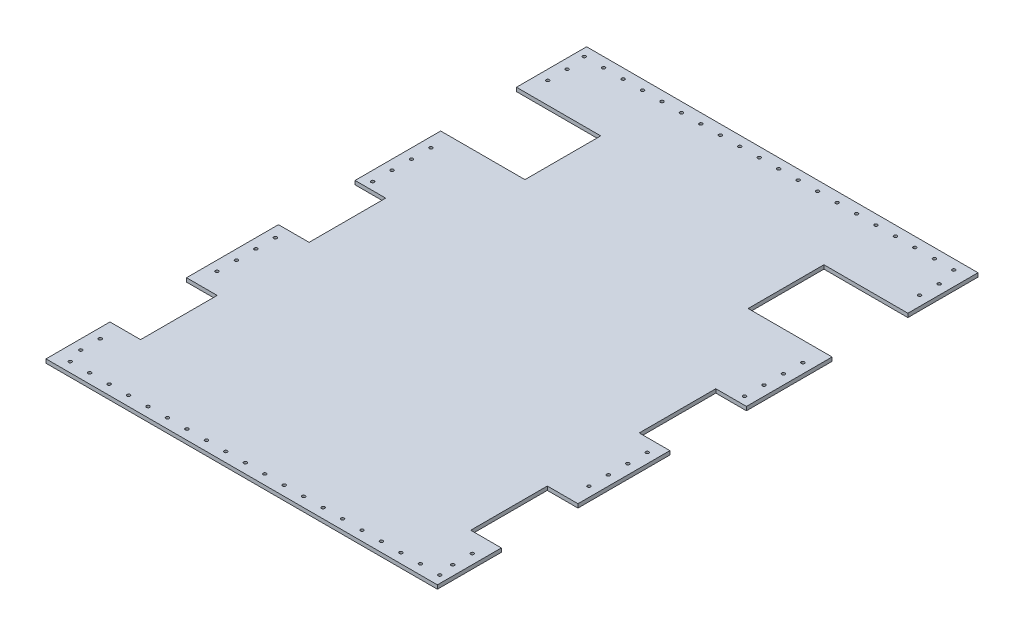
from build123d import *

# Parameters (mm, degrees)
CROQUIS1_W              = 511
CROQUIS1_H              = 705.8
SALIENTE_EXTRUIR1_DEPTH = 5
CROQUIS2_W              = 40
CROQUIS2_H              = 100
CORTAR_EXTRUIR1_DEPTH   = 10
CROQUIS4_W              = 110
CROQUIS4_H              = 98.950839499
CORTAR_EXTRUIR3_DEPTH   = 10
CROQUIS7_R              = 2.07
CORTAR_EXTRUIR6_DEPTH   = 10
CROQUIS8_R              = 2.07
CORTAR_EXTRUIR7_DEPTH   = 10


with BuildPart() as part:
    # Croquis1 → Saliente-Extruir1 (new body)
    with BuildSketch(Plane(origin=(0, 0, 0), x_dir=(1, 0, 0), z_dir=(0, 1, 0))):
        Rectangle(CROQUIS1_W, CROQUIS1_H)
    extrude(amount=SALIENTE_EXTRUIR1_DEPTH)

    # Croquis2 → Cortar-Extruir1 (cut)
    with BuildSketch(Plane(origin=(0, 0, 0), x_dir=(-1, 0, 0), z_dir=(0, -1, 0))):
        with Locations((235.5, -219.401276077)):
            Rectangle(CROQUIS2_W, CROQUIS2_H)
        with Locations((-235.5, -219.401276077)):
            Rectangle(CROQUIS2_W, CROQUIS2_H)
        with Locations((235.5, 0.598723923)):
            Rectangle(CROQUIS2_W, CROQUIS2_H)
        with Locations((-235.5, 0.598723923)):
            Rectangle(CROQUIS2_W, CROQUIS2_H)
    extrude(amount=-CORTAR_EXTRUIR1_DEPTH, mode=Mode.SUBTRACT)

    # Croquis4 → Cortar-Extruir3 (cut)
    with BuildSketch(Plane(origin=(0, 0, 0), x_dir=(-1, 0, 0), z_dir=(0, -1, 0))):
        with Locations((200.5, 211.875419749)):
            Rectangle(CROQUIS4_W, CROQUIS4_H)
        with Locations((-200.9, 211.875419749)):
            Rectangle(CROQUIS4_W, CROQUIS4_H)
    extrude(amount=-CORTAR_EXTRUIR3_DEPTH, mode=Mode.SUBTRACT)

    # Croquis7 → Cortar-Extruir6 (cut)
    with BuildSketch(Plane(origin=(0, 0, 0), x_dir=(-1, 0, 0), z_dir=(0, -1, 0))):
        with Locations(Location((236.6, -340.2, 0), (0, 0, 90))):
            Circle(CROQUIS7_R)
        with Locations(Location((211.2, -340.2, 0), (0, 0, 90))):
            Circle(CROQUIS7_R)
        with Locations(Location((185.8, -340.2, 0), (0, 0, 90))):
            Circle(CROQUIS7_R)
        with Locations(Location((160.4, -340.2, 0), (0, 0, 90))):
            Circle(CROQUIS7_R)
        with Locations(Location((135, -340.2, 0), (0, 0, 90))):
            Circle(CROQUIS7_R)
        with Locations(Location((109.6, -340.2, 0), (0, 0, 90))):
            Circle(CROQUIS7_R)
        with Locations(Location((84.2, -340.2, 0), (0, 0, 90))):
            Circle(CROQUIS7_R)
        with Locations(Location((58.8, -340.2, 0), (0, 0, 90))):
            Circle(CROQUIS7_R)
        with Locations(Location((33.4, -340.2, 0), (0, 0, 90))):
            Circle(CROQUIS7_R)
        with Locations(Location((8, -340.2, 0), (0, 0, 90))):
            Circle(CROQUIS7_R)
        with Locations(Location((-17.4, -340.2, 0), (0, 0, 90))):
            Circle(CROQUIS7_R)
        with Locations(Location((-42.8, -340.2, 0), (0, 0, 90))):
            Circle(CROQUIS7_R)
        with Locations(Location((-68.2, -340.2, 0), (0, 0, 90))):
            Circle(CROQUIS7_R)
        with Locations(Location((-93.6, -340.2, 0), (0, 0, 90))):
            Circle(CROQUIS7_R)
        with Locations(Location((-119, -340.2, 0), (0, 0, 90))):
            Circle(CROQUIS7_R)
        with Locations(Location((-144.4, -340.2, 0), (0, 0, 90))):
            Circle(CROQUIS7_R)
        with Locations(Location((-169.8, -340.2, 0), (0, 0, 90))):
            Circle(CROQUIS7_R)
        with Locations(Location((-195.2, -340.2, 0), (0, 0, 90))):
            Circle(CROQUIS7_R)
        with Locations(Location((-220.6, -340.2, 0), (0, 0, 90))):
            Circle(CROQUIS7_R)
        with Locations(Location((-246, -340.2, 0), (0, 0, 90))):
            Circle(CROQUIS7_R)
        with Locations(Location((242.8, -320.2, 0), (0, 0, 90))):
            Circle(CROQUIS7_R)
        with Locations(Location((242.8, -294.8, 0), (0, 0, 90))):
            Circle(CROQUIS7_R)
        with Locations(Location((242.8, -142.4, 0), (0, 0, 90))):
            Circle(CROQUIS7_R)
        with Locations(Location((242.8, -117, 0), (0, 0, 90))):
            Circle(CROQUIS7_R)
        with Locations(Location((242.8, -91.6, 0), (0, 0, 90))):
            Circle(CROQUIS7_R)
        with Locations(Location((242.8, -66.2, 0), (0, 0, 90))):
            Circle(CROQUIS7_R)
        with Locations(Location((242.8, 60.8, 0), (0, 0, 90))):
            Circle(CROQUIS7_R)
        with Locations(Location((242.8, 86.2, 0), (0, 0, 90))):
            Circle(CROQUIS7_R)
        with Locations(Location((242.8, 111.6, 0), (0, 0, 90))):
            Circle(CROQUIS7_R)
        with Locations(Location((242.8, 137, 0), (0, 0, 90))):
            Circle(CROQUIS7_R)
        with Locations(Location((242.8, 289.4, 0), (0, 0, 90))):
            Circle(CROQUIS7_R)
        with Locations(Location((242.8, 314.8, 0), (0, 0, 90))):
            Circle(CROQUIS7_R)
    extrude(amount=-CORTAR_EXTRUIR6_DEPTH, mode=Mode.SUBTRACT)

    # Croquis8 → Cortar-Extruir7 (cut)
    with BuildSketch(Plane(origin=(0, 0, 0), x_dir=(-1, 0, 0), z_dir=(0, -1, 0))):
        with Locations(Location((246, 340.2, 0), (0, 0, 90))):
            Circle(CROQUIS8_R)
        with Locations(Location((220.6, 340.2, 0), (0, 0, 90))):
            Circle(CROQUIS8_R)
        with Locations(Location((195.2, 340.2, 0), (0, 0, 90))):
            Circle(CROQUIS8_R)
        with Locations(Location((169.8, 340.2, 0), (0, 0, 90))):
            Circle(CROQUIS8_R)
        with Locations(Location((144.4, 340.2, 0), (0, 0, 90))):
            Circle(CROQUIS8_R)
        with Locations(Location((119, 340.2, 0), (0, 0, 90))):
            Circle(CROQUIS8_R)
        with Locations(Location((93.6, 340.2, 0), (0, 0, 90))):
            Circle(CROQUIS8_R)
        with Locations(Location((68.2, 340.2, 0), (0, 0, 90))):
            Circle(CROQUIS8_R)
        with Locations(Location((42.8, 340.2, 0), (0, 0, 90))):
            Circle(CROQUIS8_R)
        with Locations(Location((17.4, 340.2, 0), (0, 0, 90))):
            Circle(CROQUIS8_R)
        with Locations(Location((-8, 340.2, 0), (0, 0, 90))):
            Circle(CROQUIS8_R)
        with Locations(Location((-33.4, 340.2, 0), (0, 0, 90))):
            Circle(CROQUIS8_R)
        with Locations(Location((-58.8, 340.2, 0), (0, 0, 90))):
            Circle(CROQUIS8_R)
        with Locations(Location((-84.2, 340.2, 0), (0, 0, 90))):
            Circle(CROQUIS8_R)
        with Locations(Location((-109.6, 340.2, 0), (0, 0, 90))):
            Circle(CROQUIS8_R)
        with Locations(Location((-135, 340.2, 0), (0, 0, 90))):
            Circle(CROQUIS8_R)
        with Locations(Location((-160.4, 340.2, 0), (0, 0, 90))):
            Circle(CROQUIS8_R)
        with Locations(Location((-185.8, 340.2, 0), (0, 0, 90))):
            Circle(CROQUIS8_R)
        with Locations(Location((-211.2, 340.2, 0), (0, 0, 90))):
            Circle(CROQUIS8_R)
        with Locations(Location((-236.6, 340.2, 0), (0, 0, 90))):
            Circle(CROQUIS8_R)
        with Locations(Location((-242.8, 314.8, 0), (0, 0, 90))):
            Circle(CROQUIS8_R)
        with Locations(Location((-242.8, 289.4, 0), (0, 0, 90))):
            Circle(CROQUIS8_R)
        with Locations(Location((-242.8, 137, 0), (0, 0, 90))):
            Circle(CROQUIS8_R)
        with Locations(Location((-242.8, 111.6, 0), (0, 0, 90))):
            Circle(CROQUIS8_R)
        with Locations(Location((-242.8, 86.2, 0), (0, 0, 90))):
            Circle(CROQUIS8_R)
        with Locations(Location((-242.8, 60.8, 0), (0, 0, 90))):
            Circle(CROQUIS8_R)
        with Locations(Location((-242.8, -66.2, 0), (0, 0, 90))):
            Circle(CROQUIS8_R)
        with Locations(Location((-242.8, -91.6, 0), (0, 0, 90))):
            Circle(CROQUIS8_R)
        with Locations(Location((-242.8, -117, 0), (0, 0, 90))):
            Circle(CROQUIS8_R)
        with Locations(Location((-242.8, -142.4, 0), (0, 0, 90))):
            Circle(CROQUIS8_R)
        with Locations(Location((-242.8, -294.8, 0), (0, 0, 90))):
            Circle(CROQUIS8_R)
        with Locations(Location((-242.8, -320.2, 0), (0, 0, 90))):
            Circle(CROQUIS8_R)
    extrude(amount=-CORTAR_EXTRUIR7_DEPTH, mode=Mode.SUBTRACT)


solid = part.part
